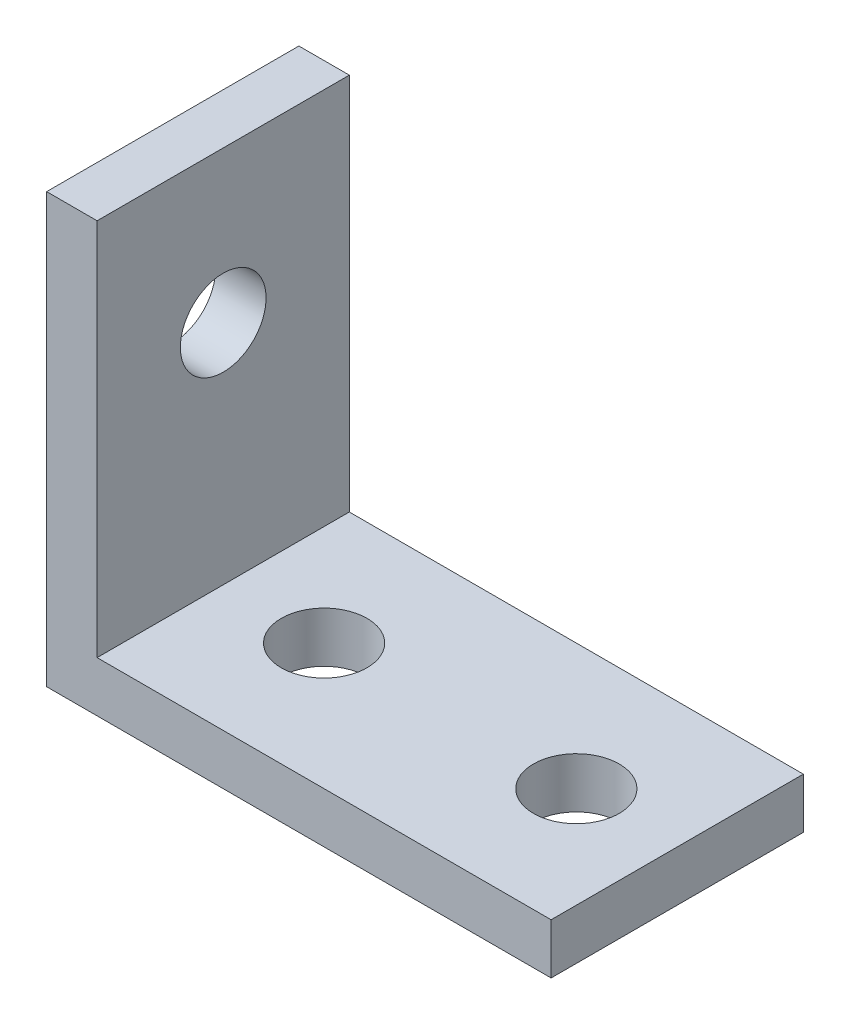
from build123d import *

# Parameters (mm, degrees)
BOSS_EXTRUDE2_DEPTH = 5
SKETCH4_R           = 0.85
CUT_EXTRUDE1_DEPTH  = 6
SKETCH6_R           = 0.85
CUT_EXTRUDE2_DEPTH  = 6


with BuildPart() as part:
    # Sketch3 → Boss-Extrude2 (new body)
    with BuildSketch(Plane.XY):
        Polygon((0, 0), (10, 0), (10, 1), (1, 1), (1, 8.5), (0, 8.5), align=None)
    extrude(amount=BOSS_EXTRUDE2_DEPTH)

    # Sketch4 → Cut-Extrude1 (cut)
    with BuildSketch(Plane(origin=(1, 0, 0), x_dir=(0, 0, -1), z_dir=(1, 0, 0))):
        with Locations((-2.5, 5.5)):
            Circle(SKETCH4_R)
    extrude(amount=-CUT_EXTRUDE1_DEPTH, mode=Mode.SUBTRACT)

    # Sketch6 → Cut-Extrude2 (cut)
    with BuildSketch(Plane(origin=(0, 1, 0), x_dir=(1, 0, 0), z_dir=(0, 1, 0))):
        with Locations((3, -2.5)):
            Circle(SKETCH6_R)
        with Locations((8, -2.5)):
            Circle(SKETCH6_R)
    extrude(amount=-CUT_EXTRUDE2_DEPTH, mode=Mode.SUBTRACT)


solid = part.part
